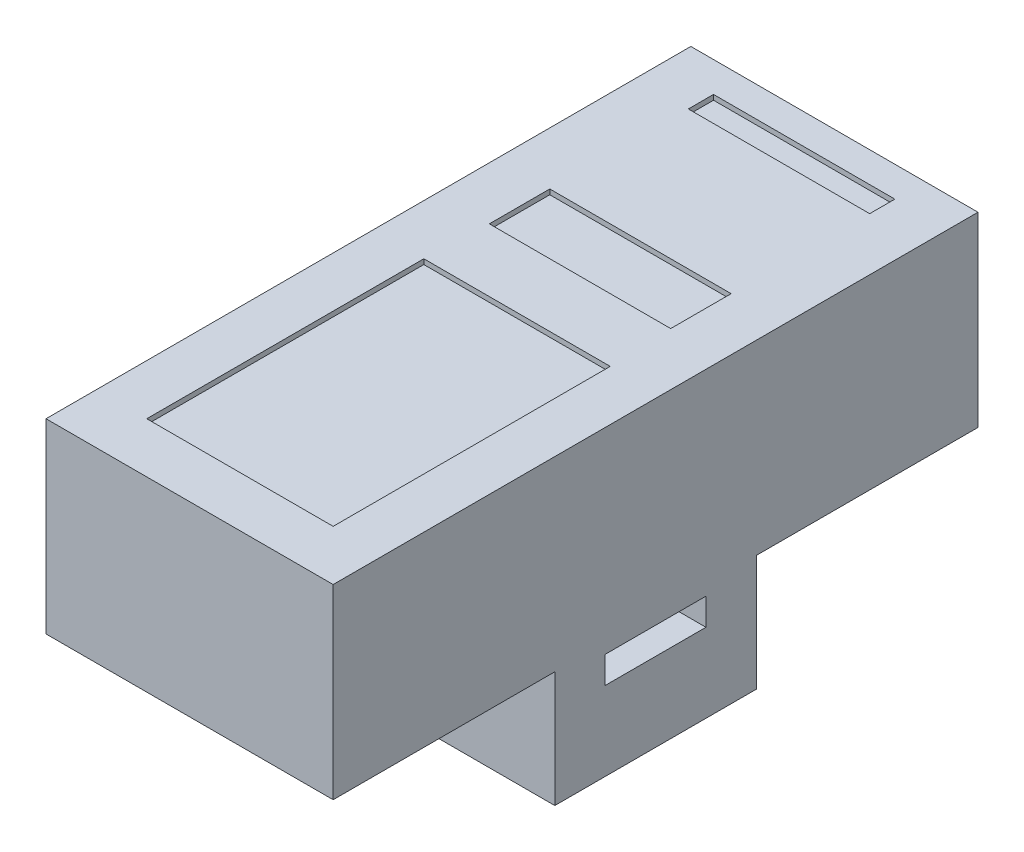
from build123d import *

# Parameters (mm, degrees)
SKETCH_1_W   = 12.8
SKETCH_1_H   = 3.7
BODY_DEPTH   = 5.7
TEETH_START  = -5.7
SKETCH_2_W   = 4
SKETCH_2_H   = 2.3
SKETCH_2_W_2 = 2
SKETCH_2_H_2 = 0.535055338
TEETH_DEPTH  = 5.7
SKETCH_3_W   = 3.7
SKETCH_3_H   = 5.5
SKETCH_3_W_2 = 3.6
SKETCH_3_H_2 = 1.2
SKETCH_3_H_3 = 0.5
CUTS_DEPTH   = 0.1
TEXT1_DEPTH  = 0.1
TEXT2_DEPTH  = 0.1


with BuildPart() as part:
    # Эскиз1 → Body (new body)
    with BuildSketch(Plane.ZY):
        with Locations((0, 3.1)):
            Rectangle(SKETCH_1_W, SKETCH_1_H)
    extrude(amount=-BODY_DEPTH)

    # Эскиз2 → Teeth (add)
    with BuildSketch(Plane.ZY.offset(TEETH_START)):
        with Locations((0, 0.1)):
            Rectangle(SKETCH_2_W, SKETCH_2_H)
        with Locations((0, 0.782472331)):
            Rectangle(SKETCH_2_W_2, SKETCH_2_H_2, mode=Mode.SUBTRACT)
    teeth = extrude(amount=TEETH_DEPTH)

    # Mirror 2: Teeth across plane
    add(teeth.mirror(Plane.ZY.offset(-2.85)))

    # Эскиз3 → Cuts (cut)
    with BuildSketch(Plane(origin=(0, 4.95, 0), x_dir=(1, 0, 0), z_dir=(0, 1, 0))):
        with Locations((2.85, -2.65)):
            Rectangle(SKETCH_3_W, SKETCH_3_H)
        with Locations((2.85, 1.95)):
            Rectangle(SKETCH_3_W_2, SKETCH_3_H_2)
        with Locations((2.85, 5.55)):
            Rectangle(SKETCH_3_W_2, SKETCH_3_H_3)
    extrude(amount=-CUTS_DEPTH, mode=Mode.SUBTRACT)

    # Эскиз4 → Text1 (add)
    # profile 1 of 5: a face of its own
    with BuildSketch(Plane.ZY):
        with BuildLine():
            Line((-4.853472261, 1.906708563), (-4.71244662, 1.873855999))
            add(Edge.make_bspline(
                [(-4.71244662, 1.873855999), (-4.715979706, 1.860638058), (-4.72289086, 1.834782123), (-4.736555053, 1.797779419), (-4.751891433, 1.76305396), (-4.769272131, 1.730697218), (-4.788887376, 1.700895225), (-4.810217446, 1.673264968), (-4.834107192, 1.64838588), (-4.859680072, 1.625683763), (-4.887135199, 1.605660557), (-4.916141558, 1.588370151), (-4.946558938, 1.573659525), (-4.978510277, 1.56156241), (-5.012016289, 1.552458293), (-5.046904452, 1.54582268), (-5.083276497, 1.541735528), (-5.108068929, 1.541197443), (-5.120699825, 1.540923307)],
                knots=[0, 0, 0, 0, 1.145254194, 2.240259345, 3.299159039, 4.322497661, 5.312016644, 6.284080175, 7.241264552, 8.196044782, 9.144516039, 10.082428046, 11.020306713, 11.970622414, 12.939253955, 13.924100776, 14.94240044, 16, 16, 16, 16], degree=3))
            add(Edge.make_bspline(
                [(-5.120699825, 1.540923307), (-5.133659368, 1.541111586), (-5.159013679, 1.541479938), (-5.196156283, 1.544476021), (-5.231482546, 1.549672259), (-5.264926498, 1.556891689), (-5.296600707, 1.565818065), (-5.326373829, 1.577048237), (-5.354193715, 1.590501175), (-5.380292419, 1.605800642), (-5.404559093, 1.623181526), (-5.427545568, 1.642174764), (-5.448693809, 1.663303218), (-5.468532602, 1.686068026), (-5.486629851, 1.710769488), (-5.503651359, 1.737072024), (-5.518766314, 1.765439083), (-5.532534865, 1.79534474), (-5.544619817, 1.826499454), (-5.555310773, 1.858287833), (-5.564051213, 1.890773219), (-5.571576169, 1.923682253), (-5.577042684, 1.957291842), (-5.581382928, 1.991349812), (-5.583769281, 2.026064967), (-5.5840833, 2.049400241), (-5.584241491, 2.061155679)],
                knots=[0, 0, 0, 0, 1.180702053, 2.309949215, 3.392367133, 4.431746864, 5.425408375, 6.388154007, 7.326956194, 8.237882283, 9.141054626, 10.043899035, 10.951650021, 11.86168169, 12.792564695, 13.739356664, 14.713891418, 15.718426911, 16.737522708, 17.757217648, 18.772674716, 19.801476837, 20.831699174, 21.873853055, 22.928926693, 24, 24, 24, 24], degree=3))
            add(Edge.make_bspline(
                [(-5.584241491, 2.061155679), (-5.584015245, 2.073846148), (-5.583568239, 2.09891931), (-5.581044898, 2.135915489), (-5.576410436, 2.171621328), (-5.569974516, 2.206060312), (-5.561830503, 2.239260334), (-5.551777631, 2.271237567), (-5.53994307, 2.301951097), (-5.526362898, 2.331434793), (-5.510946892, 2.359359537), (-5.494155156, 2.385765028), (-5.475587143, 2.4102177), (-5.455793366, 2.433184726), (-5.434279463, 2.454283681), (-5.411111129, 2.473562358), (-5.386488249, 2.491196604), (-5.360414417, 2.507022708), (-5.333230449, 2.520909287), (-5.305340115, 2.533278184), (-5.276632482, 2.543416176), (-5.247335152, 2.551845509), (-5.217385052, 2.558556041), (-5.1867122, 2.563043395), (-5.155344937, 2.565967702), (-5.134194679, 2.566364016), (-5.123504312, 2.566564332)],
                knots=[0, 0, 0, 0, 1.185634383, 2.342514083, 3.462112933, 4.547331452, 5.613960142, 6.653690668, 7.676612054, 8.686959706, 9.683658101, 10.654407272, 11.607580201, 12.5494388, 13.484601218, 14.419076806, 15.362504069, 16.311442244, 17.265594461, 18.212500624, 19.159571152, 20.107257795, 21.059246075, 22.024387127, 23.001429356, 24, 24, 24, 24], degree=3))
            add(Edge.make_bspline(
                [(-5.123504312, 2.566564332), (-5.111543231, 2.566338872), (-5.088032543, 2.565895707), (-5.053534796, 2.562250589), (-5.020494962, 2.556145415), (-4.988769874, 2.548136004), (-4.958689369, 2.537169454), (-4.929926874, 2.524131486), (-4.902768518, 2.508467947), (-4.877002985, 2.490609298), (-4.8530497, 2.470522606), (-4.83057346, 2.448687734), (-4.81049073, 2.424558972), (-4.79200611, 2.398720277), (-4.77570119, 2.370813355), (-4.760976127, 2.341081525), (-4.748313001, 2.309303765), (-4.741537598, 2.287169676), (-4.738087645, 2.275899268)],
                knots=[0, 0, 0, 0, 1.098391872, 2.158997981, 3.181470371, 4.182549255, 5.160268219, 6.118029851, 7.079534476, 8.035645336, 8.993622929, 9.94770573, 10.909620999, 11.872786677, 12.862530088, 13.874594564, 14.917769567, 16, 16, 16, 16], degree=3))
            Line((-4.738087645, 2.275899268), (-4.879113286, 2.245650871))
            add(Edge.make_bspline(
                [(-4.879113286, 2.245650871), (-4.88188281, 2.25430033), (-4.887303624, 2.271229997), (-4.89692881, 2.295357782), (-4.90732369, 2.317756249), (-4.918735879, 2.338273144), (-4.931190109, 2.356913381), (-4.944399592, 2.373903505), (-4.958680814, 2.388926392), (-4.973743284, 2.402328433), (-4.989975958, 2.413745689), (-5.006998273, 2.423863257), (-5.025169143, 2.432234001), (-5.044227167, 2.439313922), (-5.064350478, 2.444702505), (-5.085457132, 2.448493585), (-5.107565673, 2.450687677), (-5.122631402, 2.451013527), (-5.130315209, 2.451179717)],
                knots=[0, 0, 0, 0, 1.235697765, 2.418642872, 3.532555292, 4.594392283, 5.610119701, 6.580908344, 7.519430642, 8.427315627, 9.319973334, 10.216139639, 11.118687699, 12.038725643, 12.980015607, 13.949697744, 14.954307006, 16, 16, 16, 16], degree=3))
            add(Edge.make_bspline(
                [(-5.130315209, 2.451179717), (-5.139136923, 2.451051723), (-5.156486631, 2.450799996), (-5.181975438, 2.448044871), (-5.206453559, 2.443986842), (-5.229738558, 2.437901478), (-5.251957852, 2.430314612), (-5.272979589, 2.420867621), (-5.292982589, 2.40979464), (-5.311743608, 2.397029173), (-5.329104977, 2.382678332), (-5.345537833, 2.367507248), (-5.360253216, 2.350808375), (-5.373812269, 2.333132343), (-5.385820151, 2.314166802), (-5.396629257, 2.294170086), (-5.406170686, 2.272978307), (-5.416571492, 2.243152483), (-5.427176508, 2.204737511), (-5.436376372, 2.157730037), (-5.442236469, 2.109981963), (-5.442888699, 2.077865738), (-5.44321585, 2.06175664)],
                knots=[0, 0, 0, 0, 0.935256702, 1.839373932, 2.716087708, 3.564631604, 4.388828665, 5.203538865, 6.005592122, 6.810952829, 7.606223804, 8.392839071, 9.180346482, 9.963639178, 10.753404291, 11.558266631, 12.372976832, 13.215232055, 14.905983541, 16.594894834, 18.292041732, 20, 20, 20, 20], degree=3))
            add(Edge.make_bspline(
                [(-5.44321585, 2.06175664), (-5.442846871, 2.041502146), (-5.442131016, 2.002206592), (-5.435067295, 1.945260844), (-5.424297683, 1.89214579), (-5.411300313, 1.850705464), (-5.398262645, 1.8201383), (-5.387718434, 1.798731674), (-5.375682638, 1.77892302), (-5.362454631, 1.760599844), (-5.347864023, 1.743815593), (-5.332114089, 1.728481108), (-5.315201312, 1.714448835), (-5.296925292, 1.702375651), (-5.277989495, 1.691655716), (-5.258632875, 1.682123345), (-5.238843246, 1.674061288), (-5.218540765, 1.667798518), (-5.198010533, 1.662386614), (-5.17702643, 1.658851305), (-5.155594441, 1.656856087), (-5.141203391, 1.656492109), (-5.133920979, 1.656307922)],
                knots=[0, 0, 0, 0, 2.10686522, 4.087509323, 5.961373225, 7.741398778, 8.594514555, 9.418024779, 10.222433421, 11.003575649, 11.767087398, 12.533660211, 13.289033706, 14.050297079, 14.809623433, 15.552362432, 16.294320901, 17.0305302, 17.761969017, 18.502233515, 19.242073914, 20, 20, 20, 20], degree=3))
            add(Edge.make_bspline(
                [(-5.133920979, 1.656307922), (-5.125230417, 1.656490182), (-5.108063485, 1.656850208), (-5.082894582, 1.660001542), (-5.058632107, 1.664645444), (-5.035569997, 1.671811455), (-5.013398038, 1.680585395), (-4.992297893, 1.691405198), (-4.972335919, 1.704418263), (-4.953277318, 1.719193375), (-4.935473549, 1.736004929), (-4.919157351, 1.754717481), (-4.904519878, 1.77541634), (-4.890947258, 1.797769318), (-4.879543762, 1.822444183), (-4.868981432, 1.848705484), (-4.860180136, 1.87698485), (-4.855740339, 1.896658331), (-4.853472261, 1.906708563)],
                knots=[0, 0, 0, 0, 1.013374089, 2.001772144, 2.95501459, 3.891367103, 4.814208647, 5.733921849, 6.652182523, 7.590185968, 8.54346024, 9.504121027, 10.481158517, 11.497760682, 12.549996529, 13.647863555, 14.798406869, 16, 16, 16, 16], degree=3))
        make_face()
    # profile 2 of 5: a face of its own
    with BuildSketch(Plane.ZY):
        Polygon((-0.686805594, 1.55374382), (-0.686805594, 2.55374382), (-0.537767132, 2.55374382), (-0.058600466, 1.807549909), (-0.058600466, 2.55374382), (0.082425175, 2.55374382), (0.082425175, 1.55374382), (-0.066613286, 1.55374382), (-0.545779953, 2.29993773), (-0.545779953, 1.55374382), align=None)
    # profile 3 of 5: a face of its own
    with BuildSketch(Plane.ZY):
        with BuildLine():
            add(Edge.make_bspline(
                [(0.261912355, 2.040522666), (0.262259916, 2.060571804), (0.262937122, 2.099636533), (0.269264623, 2.156519811), (0.27953886, 2.210039536), (0.29422679, 2.260191537), (0.312843784, 2.307054402), (0.335476297, 2.350734246), (0.3628051, 2.390736645), (0.39372094, 2.427442394), (0.428252513, 2.459892967), (0.465018823, 2.488713724), (0.504478967, 2.512753644), (0.546268363, 2.532602692), (0.590564556, 2.547842216), (0.637243176, 2.55851127), (0.686254299, 2.565393846), (0.71975455, 2.566168503), (0.736872291, 2.566564332)],
                knots=[0, 0, 0, 0, 1.203621547, 2.345195544, 3.432004029, 4.472479546, 5.478447225, 6.455936844, 7.420185704, 8.381829745, 9.332027588, 10.260832629, 11.182364398, 12.100723901, 13.034044877, 13.989196293, 14.972532542, 16, 16, 16, 16], degree=3))
            add(Edge.make_bspline(
                [(0.736872291, 2.566564332), (0.748162617, 2.566367182), (0.770583163, 2.565975677), (0.80372994, 2.562996847), (0.836024961, 2.557680152), (0.867436423, 2.550555185), (0.89804983, 2.541207537), (0.927883463, 2.530172923), (0.956676162, 2.516499483), (0.984619476, 2.501190706), (1.011383556, 2.484067177), (1.036536372, 2.46515085), (1.060017674, 2.444584787), (1.08214288, 2.422707038), (1.102173703, 2.398779261), (1.120937667, 2.373530336), (1.137895579, 2.346512559), (1.153107609, 2.317947295), (1.16670871, 2.288275729), (1.178333477, 2.257374885), (1.188315452, 2.225615439), (1.196671208, 2.19280941), (1.202666688, 2.158968014), (1.207440953, 2.124237068), (1.209953781, 2.088503062), (1.210402894, 2.064364104), (1.210630303, 2.052141256)],
                knots=[0, 0, 0, 0, 1.034375294, 2.054082248, 3.045783978, 4.031219655, 5.002789406, 5.976610191, 6.94273282, 7.920236376, 8.894345378, 9.851183672, 10.800797181, 11.752517031, 12.698794154, 13.65688337, 14.632873302, 15.61821402, 16.620222298, 17.621258913, 18.640965868, 19.669244166, 20.720417492, 21.788124603, 22.880008887, 24, 24, 24, 24], degree=3))
            add(Edge.make_bspline(
                [(1.210630303, 2.052141256), (1.210421947, 2.039716852), (1.210010302, 2.0151703), (1.207224943, 1.978907532), (1.202327315, 1.943685793), (1.195831444, 1.909400059), (1.187127177, 1.876121704), (1.176783492, 1.843755318), (1.164272221, 1.812493681), (1.15014213, 1.782261446), (1.134153937, 1.753474412), (1.116517876, 1.726333871), (1.097221452, 1.701093701), (1.076557776, 1.67744427), (1.054044296, 1.655808474), (1.029958235, 1.635984002), (1.004392204, 1.617783887), (0.977260313, 1.601701046), (0.949049482, 1.58760386), (0.920317959, 1.575097117), (0.8910444, 1.564430869), (0.861128759, 1.555786935), (0.830652641, 1.549254957), (0.799701811, 1.544363742), (0.768174807, 1.541547364), (0.746960468, 1.541132395), (0.736271329, 1.540923307)],
                knots=[0, 0, 0, 0, 1.141429366, 2.255090526, 3.338676798, 4.407031443, 5.458968682, 6.496860253, 7.526652771, 8.550250826, 9.560787671, 10.54935636, 11.521089193, 12.477323897, 13.431786008, 14.386110112, 15.340986122, 16.312041, 17.28047646, 18.236612773, 19.189437236, 20.140779471, 21.09494583, 22.051062463, 23.018000708, 24, 24, 24, 24], degree=3))
            add(Edge.make_bspline(
                [(0.736271329, 1.540923307), (0.72477813, 1.54109335), (0.702012982, 1.541430163), (0.668365479, 1.544792133), (0.635555073, 1.549920935), (0.60367715, 1.557325376), (0.572775269, 1.566984992), (0.542812867, 1.578676686), (0.513684563, 1.592244201), (0.48575179, 1.608076021), (0.459109621, 1.625679302), (0.434016281, 1.64496654), (0.410485645, 1.665759986), (0.388895285, 1.688403331), (0.368545956, 1.712075745), (0.350251315, 1.737657116), (0.333413889, 1.764567286), (0.318531925, 1.793065657), (0.305088297, 1.822305366), (0.293761751, 1.852295766), (0.283807911, 1.882594877), (0.275880686, 1.913389452), (0.269563652, 1.944608453), (0.265315904, 1.976199934), (0.262248149, 2.008210945), (0.262024849, 2.029697891), (0.261912355, 2.040522666)],
                knots=[0, 0, 0, 0, 1.072727997, 2.12480551, 3.153819198, 4.171534612, 5.177148798, 6.173931848, 7.17235114, 8.174500385, 9.168706755, 10.151274001, 11.127173509, 12.097141049, 13.070188938, 14.039134204, 15.03036519, 16.031505612, 17.038625933, 18.033164522, 19.022845559, 20.014762458, 21.000193215, 21.994692725, 22.989758729, 24, 24, 24, 24], degree=3))
        make_face()
        with BuildLine():
            add(Edge.make_bspline(
                [(0.402937996, 2.038920102), (0.403154111, 2.024482913), (0.40357552, 1.996331415), (0.40839667, 1.955288027), (0.415711994, 1.916561501), (0.425795396, 1.880043121), (0.439349959, 1.846094049), (0.455556193, 1.814388067), (0.474959767, 1.785135939), (0.497132579, 1.758419495), (0.521520132, 1.734419443), (0.547580706, 1.713456674), (0.575320161, 1.695901838), (0.604430956, 1.681406574), (0.635122179, 1.670091698), (0.66730191, 1.662146677), (0.700993793, 1.657177712), (0.723967502, 1.656601464), (0.735670368, 1.656307922)],
                knots=[0, 0, 0, 0, 1.215430442, 2.370003584, 3.475209778, 4.53279855, 5.55522989, 6.548792651, 7.526809858, 8.505409025, 9.467826767, 10.404123909, 11.316848639, 12.227335424, 13.138360512, 14.065900994, 15.014765094, 16, 16, 16, 16], degree=3))
            add(Edge.make_bspline(
                [(0.735670368, 1.656307922), (0.747571597, 1.656605806), (0.770874171, 1.657189061), (0.805074005, 1.662071285), (0.837567676, 1.670383061), (0.868677253, 1.681447919), (0.897840307, 1.69640572), (0.925738877, 1.713921224), (0.951612445, 1.735324667), (0.976096134, 1.759367166), (0.998056354, 1.786695881), (1.017541426, 1.816637619), (1.033369727, 1.849641431), (1.047035328, 1.884980288), (1.057042069, 1.923322107), (1.064437664, 1.964231019), (1.068894406, 2.007838615), (1.069363724, 2.037774421), (1.069604662, 2.053142858)],
                knots=[0, 0, 0, 0, 0.976878588, 1.912725521, 2.8289017, 3.727303729, 4.617335839, 5.514666588, 6.426584173, 7.368641557, 8.327632997, 9.299405846, 10.294892156, 11.327373912, 12.405931897, 13.542618837, 14.738430195, 16, 16, 16, 16], degree=3))
            add(Edge.make_bspline(
                [(1.069604662, 2.053142858), (1.069519515, 2.06302991), (1.069352486, 2.082424729), (1.067140468, 2.111012913), (1.064287248, 2.138711842), (1.059943176, 2.165485772), (1.053956494, 2.191223828), (1.047324266, 2.216121954), (1.039030898, 2.23996559), (1.029620916, 2.262848244), (1.019091305, 2.28465244), (1.007215305, 2.305194359), (0.994130938, 2.324394139), (0.980191237, 2.342615789), (0.964624298, 2.359154056), (0.948179681, 2.374707525), (0.930483845, 2.388954856), (0.911713389, 2.401899773), (0.892134596, 2.413552238), (0.871787828, 2.423525236), (0.850997237, 2.432285261), (0.829414818, 2.439000189), (0.807338583, 2.444415876), (0.784679289, 2.448529595), (0.761352829, 2.45065987), (0.745623339, 2.451005191), (0.737673573, 2.451179717)],
                knots=[0, 0, 0, 0, 1.220438779, 2.394059227, 3.538503547, 4.658058814, 5.74010225, 6.800155734, 7.837851593, 8.854470756, 9.853724944, 10.825214244, 11.781044712, 12.72106398, 13.654479919, 14.581868691, 15.514082315, 16.456304431, 17.39516604, 18.324312202, 19.252140633, 20.177768678, 21.111585046, 22.057694709, 23.018348693, 24, 24, 24, 24], degree=3))
            add(Edge.make_bspline(
                [(0.737673573, 2.451179717), (0.726437662, 2.450956576), (0.704267958, 2.450516295), (0.671631514, 2.445621881), (0.640166444, 2.438308959), (0.609823917, 2.428085104), (0.580863447, 2.414547114), (0.553134994, 2.397944621), (0.526392427, 2.378729685), (0.501057437, 2.35643414), (0.477439685, 2.330822001), (0.457473245, 2.300626074), (0.440644983, 2.266567199), (0.426593695, 2.228731707), (0.415880002, 2.186826588), (0.4084755, 2.141032179), (0.403800448, 2.091300224), (0.40323283, 2.056826509), (0.402937996, 2.038920102)],
                knots=[0, 0, 0, 0, 0.895090134, 1.766112571, 2.624765742, 3.468151641, 4.313618154, 5.168136083, 6.041303099, 6.935189387, 7.854749729, 8.809996334, 9.809869957, 10.877771942, 12.021723904, 13.25217762, 14.572720513, 16, 16, 16, 16], degree=3))
        make_face(mode=Mode.SUBTRACT)
    # profile 4 of 5: a face of its own
    with BuildSketch(Plane.ZY):
        Polygon((4.082425175, 1.55374382), (4.082425175, 2.55374382), (4.231463637, 2.55374382), (4.710630303, 1.807549909), (4.710630303, 2.55374382), (4.851655944, 2.55374382), (4.851655944, 1.55374382), (4.702617483, 1.55374382), (4.223450816, 2.29993773), (4.223450816, 1.55374382), align=None)
    # profile 5 of 5: a face of its own
    with BuildSketch(Plane.ZY):
        with BuildLine():
            Line((5.761912355, 1.906708563), (5.902937996, 1.873855999))
            add(Edge.make_bspline(
                [(5.902937996, 1.873855999), (5.89940491, 1.860638058), (5.892493755, 1.834782123), (5.878829563, 1.797779419), (5.863493183, 1.76305396), (5.846112485, 1.730697218), (5.826497239, 1.700895225), (5.80516717, 1.673264968), (5.781277423, 1.64838588), (5.755704543, 1.625683763), (5.728249416, 1.605660557), (5.699243058, 1.588370151), (5.668825678, 1.573659525), (5.636874338, 1.56156241), (5.603368326, 1.552458293), (5.568480163, 1.54582268), (5.532108119, 1.541735528), (5.507315686, 1.541197443), (5.494684791, 1.540923307)],
                knots=[0, 0, 0, 0, 1.145254194, 2.240259345, 3.299159039, 4.322497661, 5.312016644, 6.284080175, 7.241264552, 8.196044782, 9.144516039, 10.082428046, 11.020306713, 11.970622414, 12.939253955, 13.924100776, 14.94240044, 16, 16, 16, 16], degree=3))
            add(Edge.make_bspline(
                [(5.494684791, 1.540923307), (5.481725247, 1.541111586), (5.456370936, 1.541479938), (5.419228333, 1.544476021), (5.383902069, 1.549672259), (5.350458117, 1.556891689), (5.318783908, 1.565818065), (5.289010786, 1.577048237), (5.261190901, 1.590501175), (5.235092196, 1.605800642), (5.210825522, 1.623181526), (5.187839048, 1.642174764), (5.166690807, 1.663303218), (5.146852013, 1.686068026), (5.128754764, 1.710769488), (5.111733257, 1.737072024), (5.096618302, 1.765439083), (5.08284975, 1.79534474), (5.070764798, 1.826499454), (5.060073842, 1.858287833), (5.051333402, 1.890773219), (5.043808447, 1.923682253), (5.038341931, 1.957291842), (5.034001687, 1.991349812), (5.031615334, 2.026064967), (5.031301315, 2.049400241), (5.031143124, 2.061155679)],
                knots=[0, 0, 0, 0, 1.180702053, 2.309949215, 3.392367133, 4.431746864, 5.425408375, 6.388154007, 7.326956194, 8.237882283, 9.141054626, 10.043899035, 10.951650021, 11.86168169, 12.792564695, 13.739356664, 14.713891418, 15.718426911, 16.737522708, 17.757217648, 18.772674716, 19.801476837, 20.831699174, 21.873853055, 22.928926693, 24, 24, 24, 24], degree=3))
            add(Edge.make_bspline(
                [(5.031143124, 2.061155679), (5.03136937, 2.073846148), (5.031816376, 2.09891931), (5.034339717, 2.135915489), (5.038974179, 2.171621328), (5.045410099, 2.206060312), (5.053554112, 2.239260334), (5.063606984, 2.271237567), (5.075441545, 2.301951097), (5.089021717, 2.331434793), (5.104437724, 2.359359537), (5.12122946, 2.385765028), (5.139797473, 2.4102177), (5.159591249, 2.433184726), (5.181105152, 2.454283681), (5.204273487, 2.473562358), (5.228896367, 2.491196604), (5.254970198, 2.507022708), (5.282154166, 2.520909287), (5.310044501, 2.533278184), (5.338752134, 2.543416176), (5.368049463, 2.551845509), (5.397999563, 2.558556041), (5.428672415, 2.563043395), (5.460039678, 2.565967702), (5.481189936, 2.566364016), (5.491880303, 2.566564332)],
                knots=[0, 0, 0, 0, 1.185634383, 2.342514083, 3.462112933, 4.547331452, 5.613960142, 6.653690668, 7.676612054, 8.686959706, 9.683658101, 10.654407272, 11.607580201, 12.5494388, 13.484601218, 14.419076806, 15.362504069, 16.311442244, 17.265594461, 18.212500624, 19.159571152, 20.107257795, 21.059246075, 22.024387127, 23.001429356, 24, 24, 24, 24], degree=3))
            add(Edge.make_bspline(
                [(5.491880303, 2.566564332), (5.503841384, 2.566338872), (5.527352073, 2.565895707), (5.561849819, 2.562250589), (5.594889653, 2.556145415), (5.626614742, 2.548136004), (5.656695246, 2.537169454), (5.685457741, 2.524131486), (5.712616098, 2.508467947), (5.73838163, 2.490609298), (5.762334916, 2.470522606), (5.784811155, 2.448687734), (5.804893886, 2.424558972), (5.823378505, 2.398720277), (5.839683425, 2.370813355), (5.854408489, 2.341081525), (5.867071615, 2.309303765), (5.873847018, 2.287169676), (5.87729697, 2.275899268)],
                knots=[0, 0, 0, 0, 1.098391872, 2.158997981, 3.181470371, 4.182549255, 5.160268219, 6.118029851, 7.079534476, 8.035645336, 8.993622929, 9.94770573, 10.909620999, 11.872786677, 12.862530088, 13.874594564, 14.917769567, 16, 16, 16, 16], degree=3))
            Line((5.87729697, 2.275899268), (5.736271329, 2.245650871))
            add(Edge.make_bspline(
                [(5.736271329, 2.245650871), (5.733501806, 2.25430033), (5.728080991, 2.271229997), (5.718455805, 2.295357782), (5.708060925, 2.317756249), (5.696648736, 2.338273144), (5.684194507, 2.356913381), (5.670985023, 2.373903505), (5.656703801, 2.388926392), (5.641641331, 2.402328433), (5.625408657, 2.413745689), (5.608386343, 2.423863257), (5.590215473, 2.432234001), (5.571157449, 2.439313922), (5.551034138, 2.444702505), (5.529927484, 2.448493585), (5.507818942, 2.450687677), (5.492753213, 2.451013527), (5.485069406, 2.451179717)],
                knots=[0, 0, 0, 0, 1.235697765, 2.418642872, 3.532555292, 4.594392283, 5.610119701, 6.580908344, 7.519430642, 8.427315627, 9.319973334, 10.216139639, 11.118687699, 12.038725643, 12.980015607, 13.949697744, 14.954307006, 16, 16, 16, 16], degree=3))
            add(Edge.make_bspline(
                [(5.485069406, 2.451179717), (5.476247692, 2.451051723), (5.458897985, 2.450799996), (5.433409177, 2.448044871), (5.408931057, 2.443986842), (5.385646058, 2.437901478), (5.363426763, 2.430314612), (5.342405026, 2.420867621), (5.322402026, 2.40979464), (5.303641007, 2.397029173), (5.286279638, 2.382678332), (5.269846782, 2.367507248), (5.255131399, 2.350808375), (5.241572347, 2.333132343), (5.229564464, 2.314166802), (5.218755358, 2.294170086), (5.209213929, 2.272978307), (5.198813123, 2.243152483), (5.188208107, 2.204737511), (5.179008243, 2.157730037), (5.173148147, 2.109981963), (5.172495916, 2.077865738), (5.172168765, 2.06175664)],
                knots=[0, 0, 0, 0, 0.935256702, 1.839373932, 2.716087708, 3.564631604, 4.388828665, 5.203538865, 6.005592122, 6.810952829, 7.606223804, 8.392839071, 9.180346482, 9.963639178, 10.753404291, 11.558266631, 12.372976832, 13.215232055, 14.905983541, 16.594894834, 18.292041732, 20, 20, 20, 20], degree=3))
            add(Edge.make_bspline(
                [(5.172168765, 2.06175664), (5.172537745, 2.041502146), (5.173253599, 2.002206592), (5.18031732, 1.945260844), (5.191086932, 1.89214579), (5.204084302, 1.850705464), (5.21712197, 1.8201383), (5.227666181, 1.798731674), (5.239701977, 1.77892302), (5.252929984, 1.760599844), (5.267520593, 1.743815593), (5.283270526, 1.728481108), (5.300183303, 1.714448835), (5.318459324, 1.702375651), (5.337395121, 1.691655716), (5.35675174, 1.682123345), (5.376541369, 1.674061288), (5.39684385, 1.667798518), (5.417374082, 1.662386614), (5.438358185, 1.658851305), (5.459790174, 1.656856087), (5.474181225, 1.656492109), (5.481463637, 1.656307922)],
                knots=[0, 0, 0, 0, 2.10686522, 4.087509323, 5.961373225, 7.741398778, 8.594514555, 9.418024779, 10.222433421, 11.003575649, 11.767087398, 12.533660211, 13.289033706, 14.050297079, 14.809623433, 15.552362432, 16.294320901, 17.0305302, 17.761969017, 18.502233515, 19.242073914, 20, 20, 20, 20], degree=3))
            add(Edge.make_bspline(
                [(5.481463637, 1.656307922), (5.490154198, 1.656490182), (5.507321131, 1.656850208), (5.532490033, 1.660001542), (5.556752508, 1.664645444), (5.579814619, 1.671811455), (5.601986577, 1.680585395), (5.623086722, 1.691405198), (5.643048696, 1.704418263), (5.662107297, 1.719193375), (5.679911067, 1.736004929), (5.696227264, 1.754717481), (5.710864737, 1.77541634), (5.724437358, 1.797769318), (5.735840854, 1.822444183), (5.746403184, 1.848705484), (5.75520448, 1.87698485), (5.759644277, 1.896658331), (5.761912355, 1.906708563)],
                knots=[0, 0, 0, 0, 1.013374089, 2.001772144, 2.95501459, 3.891367103, 4.814208647, 5.733921849, 6.652182523, 7.590185968, 8.54346024, 9.504121027, 10.481158517, 11.497760682, 12.549996529, 13.647863555, 14.798406869, 16, 16, 16, 16], degree=3))
        make_face()
    extrude(amount=TEXT1_DEPTH)

    # Эскиз5 → Text2 (add)
    # profile 1 of 9: a face of its own
    with BuildSketch(Plane.ZY):
        with BuildLine():
            Line((-3.035853379, 3.734195884), (-3.164058507, 3.734195884))
            Line((-3.164058507, 3.734195884), (-3.164058507, 4.513442679))
            add(Edge.make_bspline(
                [(-3.164058507, 4.513442679), (-3.17144057, 4.506323587), (-3.186783378, 4.491527337), (-3.212718774, 4.470586947), (-3.241665991, 4.449362974), (-3.27324913, 4.428953752), (-3.305442798, 4.40974067), (-3.336553833, 4.392461457), (-3.366062823, 4.37783905), (-3.385500555, 4.36984346), (-3.394827738, 4.366006781)],
                knots=[0, 0, 0, 0, 0.893362401, 1.856755847, 2.901947673, 4.020460078, 5.132200827, 6.168787962, 7.121294059, 8, 8, 8, 8], degree=3))
            Line((-3.394827738, 4.366006781), (-3.394827738, 4.484195884))
            add(Edge.make_bspline(
                [(-3.394827738, 4.484195884), (-3.378807337, 4.492446422), (-3.347232075, 4.508707745), (-3.302623059, 4.536793285), (-3.260975743, 4.567239167), (-3.222979556, 4.600038649), (-3.188918396, 4.633565608), (-3.160214561, 4.667395627), (-3.136197019, 4.700288642), (-3.124146963, 4.723227873), (-3.11838543, 4.734195884)],
                knots=[0, 0, 0, 0, 1.141258006, 2.249351951, 3.335817539, 4.406819942, 5.426913362, 6.360259544, 7.215985427, 8, 8, 8, 8], degree=3))
            Line((-3.11838543, 4.734195884), (-3.035853379, 4.734195884))
            Line((-3.035853379, 4.734195884), (-3.035853379, 3.734195884))
        make_face()
    # profile 2 of 9: a face of its own
    with BuildSketch(Plane.ZY):
        Polygon((-2.800877417, 3.734195884), (-2.403842161, 4.734195884), (-2.244787674, 4.734195884), (-1.847752417, 3.734195884), (-1.99739184, 3.734195884), (-2.111173892, 4.041888191), (-2.537455943, 4.041888191), (-2.651237994, 3.734195884), align=None)
        with BuildLine():
            Line((-2.494987994, 4.157272807), (-2.15364184, 4.157272807))
            Line((-2.15364184, 4.157272807), (-2.250797289, 4.42009332))
            add(Edge.make_bspline(
                [(-2.250797289, 4.42009332), (-2.254521882, 4.430248346), (-2.261804165, 4.45010334), (-2.272664242, 4.478950971), (-2.282585834, 4.506345864), (-2.292314769, 4.531895218), (-2.301097253, 4.555970162), (-2.309192293, 4.57840808), (-2.31719822, 4.599053019), (-2.322002689, 4.612391777), (-2.324314917, 4.618811268)],
                knots=[0, 0, 0, 0, 1.225184869, 2.395467751, 3.491410812, 4.525364584, 5.492066482, 6.394148129, 7.227157926, 8, 8, 8, 8], degree=3))
            add(Edge.make_bspline(
                [(-2.324314917, 4.618811268), (-2.328139789, 4.602981367), (-2.335805303, 4.571256292), (-2.351855025, 4.524774801), (-2.370215348, 4.478718404), (-2.385126119, 4.449039976), (-2.392624212, 4.434115756)],
                knots=[0, 0, 0, 0, 0.9891762, 1.982431084, 2.985436691, 4, 4, 4, 4], degree=3))
            Line((-2.392624212, 4.434115756), (-2.494987994, 4.157272807))
        make_face(mode=Mode.SUBTRACT)
    # profile 3 of 9: a face of its own
    with BuildSketch(Plane.ZY):
        with BuildLine():
            Line((-0.958930302, 3.734195884), (-1.08713543, 3.734195884))
            Line((-1.08713543, 3.734195884), (-1.08713543, 4.513442679))
            add(Edge.make_bspline(
                [(-1.08713543, 4.513442679), (-1.094517493, 4.506323587), (-1.109860301, 4.491527337), (-1.135795697, 4.470586947), (-1.164742914, 4.449362974), (-1.196326053, 4.428953752), (-1.228519721, 4.40974067), (-1.259630756, 4.392461457), (-1.289139746, 4.37783905), (-1.308577478, 4.36984346), (-1.317904661, 4.366006781)],
                knots=[0, 0, 0, 0, 0.893362401, 1.856755847, 2.901947673, 4.020460078, 5.132200827, 6.168787962, 7.121294059, 8, 8, 8, 8], degree=3))
            Line((-1.317904661, 4.366006781), (-1.317904661, 4.484195884))
            add(Edge.make_bspline(
                [(-1.317904661, 4.484195884), (-1.30188426, 4.492446422), (-1.270308998, 4.508707745), (-1.225699982, 4.536793285), (-1.184052666, 4.567239167), (-1.146056479, 4.600038649), (-1.111995319, 4.633565608), (-1.083291485, 4.667395627), (-1.059273942, 4.700288642), (-1.047223887, 4.723227873), (-1.041462353, 4.734195884)],
                knots=[0, 0, 0, 0, 1.141258006, 2.249351951, 3.335817539, 4.406819942, 5.426913362, 6.360259544, 7.215985427, 8, 8, 8, 8], degree=3))
            Line((-1.041462353, 4.734195884), (-0.958930302, 4.734195884))
            Line((-0.958930302, 4.734195884), (-0.958930302, 3.734195884))
        make_face()
    # profile 4 of 9: a face of its own
    with BuildSketch(Plane.ZY):
        with BuildLine():
            Line((-0.010212353, 3.862401012), (-0.010212353, 3.734195884))
            Line((-0.010212353, 3.734195884), (-0.664058507, 3.734195884))
            add(Edge.make_bspline(
                [(-0.664058507, 3.734195884), (-0.664071893, 3.741815475), (-0.66409862, 3.757029118), (-0.661524226, 3.779529132), (-0.657492211, 3.801730663), (-0.652933212, 3.815967623), (-0.650637033, 3.823138191)],
                knots=[0, 0, 0, 0, 1.01057331, 2.01775941, 3.001627217, 4, 4, 4, 4], degree=3))
            add(Edge.make_bspline(
                [(-0.650637033, 3.823138191), (-0.646394457, 3.834854046), (-0.637755874, 3.858709454), (-0.620254014, 3.893129477), (-0.599667691, 3.927341335), (-0.579624008, 3.955194617), (-0.561268322, 3.977447442), (-0.545874688, 3.994857703), (-0.528815718, 4.012679156), (-0.510105076, 4.030908547), (-0.489922839, 4.049663939), (-0.46824147, 4.069007882), (-0.444804945, 4.088579879), (-0.428443798, 4.101553014), (-0.420068122, 4.108194281)],
                knots=[0, 0, 0, 0, 1.204657718, 2.452881516, 3.728232997, 5.065887527, 5.768225529, 6.518857853, 7.313994055, 8.154655305, 9.046094665, 9.979688118, 10.965752482, 12, 12, 12, 12], degree=3))
            add(Edge.make_bspline(
                [(-0.420068122, 4.108194281), (-0.407201017, 4.119024315), (-0.382424588, 4.139878233), (-0.347436388, 4.170823514), (-0.315480363, 4.19955796), (-0.287065376, 4.226585202), (-0.261959021, 4.251643092), (-0.24010235, 4.274674858), (-0.2213073, 4.295608623), (-0.205803322, 4.315202101), (-0.192722141, 4.333703794), (-0.181636994, 4.351751053), (-0.172398996, 4.369659123), (-0.164704979, 4.38737134), (-0.158619665, 4.404963449), (-0.154471659, 4.422486702), (-0.151658624, 4.439767228), (-0.151377177, 4.451265881), (-0.151237994, 4.456952294)],
                knots=[0, 0, 0, 0, 1.782554561, 3.432421876, 4.950675607, 6.337395053, 7.588547463, 8.709982106, 9.702713005, 10.569305638, 11.356701089, 12.103210377, 12.812277205, 13.490692607, 14.148717897, 14.782152033, 15.397739362, 16, 16, 16, 16], degree=3))
            add(Edge.make_bspline(
                [(-0.151237994, 4.456952294), (-0.151377194, 4.462572359), (-0.151650297, 4.473598621), (-0.154241484, 4.489735487), (-0.157848624, 4.505275674), (-0.163680271, 4.519939426), (-0.170621686, 4.534160992), (-0.179525728, 4.547490989), (-0.189825873, 4.560261636), (-0.201618667, 4.57213623), (-0.21449916, 4.583276495), (-0.228891276, 4.592536761), (-0.243849743, 4.60087376), (-0.259890618, 4.607577185), (-0.276987833, 4.61249963), (-0.29501693, 4.616072057), (-0.313975048, 4.618337167), (-0.32691263, 4.618650839), (-0.333529661, 4.618811268)],
                knots=[0, 0, 0, 0, 0.988194508, 1.938783882, 2.870742509, 3.789494954, 4.709148727, 5.651055405, 6.603531303, 7.592354411, 8.592907906, 9.593461401, 10.59787167, 11.603930315, 12.645063138, 13.723588815, 14.835711238, 16, 16, 16, 16], degree=3))
            add(Edge.make_bspline(
                [(-0.333529661, 4.618811268), (-0.340480667, 4.618651633), (-0.354084298, 4.618339215), (-0.373969163, 4.616065071), (-0.392846395, 4.612590487), (-0.410670938, 4.607278144), (-0.427421096, 4.600585897), (-0.443028651, 4.592162141), (-0.457743543, 4.582653243), (-0.471102345, 4.571395426), (-0.483182535, 4.558912803), (-0.493906931, 4.545323002), (-0.502693962, 4.530363769), (-0.509950654, 4.514364023), (-0.515785642, 4.497273468), (-0.520021645, 4.478961449), (-0.522331143, 4.45948084), (-0.522795563, 4.446140525), (-0.523032866, 4.439324089)],
                knots=[0, 0, 0, 0, 1.131143733, 2.213731411, 3.253917892, 4.251203413, 5.236093891, 6.184197493, 7.13373276, 8.082770301, 9.020476205, 9.957489029, 10.893177274, 11.836722509, 12.812818608, 13.827831385, 14.890097571, 16, 16, 16, 16], degree=3))
            Line((-0.523032866, 4.439324089), (-0.651237994, 4.452144602))
            add(Edge.make_bspline(
                [(-0.651237994, 4.452144602), (-0.649926274, 4.463317992), (-0.647374434, 4.485054861), (-0.64101815, 4.516537054), (-0.632094502, 4.545824518), (-0.621416605, 4.573325582), (-0.608030854, 4.598572094), (-0.592899415, 4.62208625), (-0.575052581, 4.643122281), (-0.555336565, 4.662343271), (-0.533535355, 4.679282021), (-0.509853741, 4.694080371), (-0.484302555, 4.706458277), (-0.457024108, 4.716706667), (-0.427955776, 4.724482378), (-0.397138681, 4.730058297), (-0.364523263, 4.733495357), (-0.342151951, 4.733959043), (-0.330725174, 4.734195884)],
                knots=[0, 0, 0, 0, 1.130804643, 2.199883102, 3.223565206, 4.205909148, 5.160801384, 6.091796021, 7.01151579, 7.927798993, 8.855738875, 9.7815393, 10.730299821, 11.705391175, 12.706931101, 13.751121791, 14.851322166, 16, 16, 16, 16], degree=3))
            add(Edge.make_bspline(
                [(-0.330725174, 4.734195884), (-0.319161624, 4.733997871), (-0.296635762, 4.733612141), (-0.26381196, 4.72966535), (-0.232841795, 4.72351826), (-0.203611733, 4.714951097), (-0.176294467, 4.703716993), (-0.150868986, 4.689991453), (-0.127218056, 4.673908368), (-0.105736838, 4.65527467), (-0.086366661, 4.634932868), (-0.069391558, 4.613223779), (-0.055199554, 4.590240146), (-0.043115945, 4.566295252), (-0.034153085, 4.540883156), (-0.027850237, 4.514349341), (-0.023567269, 4.486671133), (-0.023213369, 4.467786228), (-0.023032866, 4.458154217)],
                knots=[0, 0, 0, 0, 1.195390245, 2.328627238, 3.413424916, 4.457841177, 5.473507151, 6.462241215, 7.441013641, 8.425227782, 9.397253344, 10.342087291, 11.269524934, 12.186751184, 13.110685745, 14.048630397, 15.004728144, 16, 16, 16, 16], degree=3))
            add(Edge.make_bspline(
                [(-0.023032866, 4.458154217), (-0.023308491, 4.448258417), (-0.023860348, 4.428444978), (-0.028167669, 4.39882973), (-0.035537544, 4.369535874), (-0.045308031, 4.340206885), (-0.05865655, 4.310726358), (-0.075520137, 4.280687608), (-0.09644126, 4.249979676), (-0.116561514, 4.223874521), (-0.135290205, 4.201991819), (-0.151891419, 4.183981076), (-0.171098064, 4.164845867), (-0.192189625, 4.143923494), (-0.216026318, 4.121956536), (-0.24192326, 4.09828718), (-0.270447346, 4.073538313), (-0.290248621, 4.056631075), (-0.300476776, 4.047897807)],
                knots=[0, 0, 0, 0, 0.927118007, 1.856282007, 2.79721255, 3.754929441, 4.749232485, 5.824981375, 6.979078785, 8.228161913, 8.911614355, 9.677694854, 10.522803217, 11.452009355, 12.461436787, 13.560019032, 14.739651695, 16, 16, 16, 16], degree=3))
            add(Edge.make_bspline(
                [(-0.300476776, 4.047897807), (-0.309235646, 4.040767153), (-0.325937463, 4.027170094), (-0.349699032, 4.007458073), (-0.370982171, 3.989382684), (-0.390284583, 3.973533512), (-0.406903285, 3.959143952), (-0.421423649, 3.946844204), (-0.433318142, 3.936015841), (-0.45143135, 3.919567339), (-0.474373272, 3.896121663), (-0.491277861, 3.873340154), (-0.499395045, 3.862401012)],
                knots=[0, 0, 0, 0, 1.241996727, 2.368296581, 3.394949853, 4.3125351, 5.114548721, 5.812230366, 6.404953749, 6.883082049, 8.503329734, 10, 10, 10, 10], degree=3))
            Line((-0.499395045, 3.862401012), (-0.010212353, 3.862401012))
        make_face()
    # profile 5 of 9: a face of its own
    with BuildSketch(Plane.ZY):
        with BuildLine():
            Line((0.130813288, 4.003426653), (0.259018416, 4.016247166))
            add(Edge.make_bspline(
                [(0.259018416, 4.016247166), (0.260287848, 4.00902351), (0.262757091, 3.994972377), (0.267462506, 3.974632945), (0.2735735, 3.955737045), (0.280439876, 3.938121026), (0.288601721, 3.921971156), (0.297445148, 3.907032437), (0.307874163, 3.893835148), (0.318838872, 3.881689057), (0.330873478, 3.870986203), (0.344094105, 3.861963328), (0.358131891, 3.854091415), (0.373157809, 3.847646243), (0.389194888, 3.842928717), (0.40603902, 3.839197963), (0.423907103, 3.837318054), (0.436098375, 3.836948388), (0.442311685, 3.836759986)],
                knots=[0, 0, 0, 0, 1.237781394, 2.407677316, 3.51963579, 4.58689595, 5.594855907, 6.570874, 7.510833816, 8.428091223, 9.330271693, 10.221190844, 11.124215526, 12.043132878, 12.973586933, 13.941700858, 14.950982896, 16, 16, 16, 16], degree=3))
            add(Edge.make_bspline(
                [(0.442311685, 3.836759986), (0.449934026, 3.836944164), (0.464839844, 3.837304332), (0.486524986, 3.840350487), (0.507008359, 3.845373244), (0.526191953, 3.852402218), (0.544300659, 3.86114358), (0.560733731, 3.872462051), (0.576387191, 3.885185131), (0.590253734, 3.900353484), (0.602876185, 3.91686677), (0.613770309, 3.934891724), (0.622941622, 3.954175351), (0.630662866, 3.974713956), (0.63636444, 3.996624867), (0.640558409, 4.019791522), (0.64325077, 4.044228679), (0.643504313, 4.060978234), (0.643633801, 4.069532422)],
                knots=[0, 0, 0, 0, 1.052816602, 2.058828735, 3.018813999, 3.961574988, 4.877590722, 5.788574389, 6.712363302, 7.658909047, 8.620312049, 9.580784896, 10.562948504, 11.56722449, 12.607883026, 13.686460295, 14.818448981, 16, 16, 16, 16], degree=3))
            add(Edge.make_bspline(
                [(0.643633801, 4.069532422), (0.643486627, 4.077684452), (0.643200046, 4.093558345), (0.640786569, 4.116673372), (0.636714748, 4.138408492), (0.631446193, 4.159003266), (0.624184154, 4.178135873), (0.615570967, 4.196083718), (0.605019451, 4.212465895), (0.593280194, 4.227792486), (0.579872479, 4.241532157), (0.564615172, 4.253133569), (0.548106808, 4.263287147), (0.530014891, 4.271521066), (0.510328767, 4.277638558), (0.489244063, 4.282345417), (0.466541994, 4.284821033), (0.450930597, 4.285255034), (0.442912647, 4.285477935)],
                knots=[0, 0, 0, 0, 1.165854935, 2.270189951, 3.319242023, 4.32700288, 5.306253956, 6.24172124, 7.169108591, 8.088047231, 8.999810445, 9.905349262, 10.822648491, 11.767237767, 12.739852311, 13.766490849, 14.852878837, 16, 16, 16, 16], degree=3))
            add(Edge.make_bspline(
                [(0.442912647, 4.285477935), (0.432942715, 4.285186295), (0.413822643, 4.284626996), (0.386349066, 4.27992181), (0.361338874, 4.272321181), (0.339075231, 4.260993369), (0.319183767, 4.247460436), (0.301251246, 4.232147309), (0.285129797, 4.215064341), (0.276286525, 4.202202849), (0.271838929, 4.195734345)],
                knots=[0, 0, 0, 0, 1.182877094, 2.268490576, 3.298955169, 4.273890847, 5.221533034, 6.149304476, 7.069219215, 8, 8, 8, 8], degree=3))
            Line((0.271838929, 4.195734345), (0.143633801, 4.208554858))
            Line((0.143633801, 4.208554858), (0.246197903, 4.721375371))
            Line((0.246197903, 4.721375371), (0.720556878, 4.721375371))
            Line((0.720556878, 4.721375371), (0.720556878, 4.593170243))
            Line((0.720556878, 4.593170243), (0.350965531, 4.593170243))
            Line((0.350965531, 4.593170243), (0.300084121, 4.33415582))
            add(Edge.make_bspline(
                [(0.300084121, 4.33415582), (0.307158137, 4.33946426), (0.321050385, 4.349889198), (0.342719801, 4.363539279), (0.364699067, 4.375045387), (0.386860236, 4.384467923), (0.409379344, 4.391808061), (0.4321205, 4.39690765), (0.455161134, 4.400354253), (0.470611238, 4.400692635), (0.478369378, 4.40086255)],
                knots=[0, 0, 0, 0, 1.093835215, 2.148119334, 3.164235237, 4.159999629, 5.123971815, 6.089888814, 7.040853737, 8, 8, 8, 8], degree=3))
            add(Edge.make_bspline(
                [(0.478369378, 4.40086255), (0.488466071, 4.400598009), (0.508348908, 4.400077063), (0.537646956, 4.395796835), (0.56566082, 4.388530864), (0.592610236, 4.37874466), (0.618139845, 4.365771375), (0.642508244, 4.350063482), (0.665617049, 4.331491505), (0.687335619, 4.310405858), (0.707035226, 4.286998574), (0.724667017, 4.262033048), (0.739067702, 4.23500954), (0.751179665, 4.206633638), (0.760314768, 4.176439541), (0.767248629, 4.144855766), (0.770955935, 4.111487442), (0.771539991, 4.088771381), (0.771838929, 4.077144602)],
                knots=[0, 0, 0, 0, 0.991958705, 1.953407265, 2.902004973, 3.832128134, 4.765371166, 5.71007953, 6.676509202, 7.674246545, 8.68000108, 9.679398714, 10.671856529, 11.683459888, 12.706765812, 13.76733029, 14.85725088, 16, 16, 16, 16], degree=3))
            add(Edge.make_bspline(
                [(0.771838929, 4.077144602), (0.771611929, 4.066050743), (0.771163541, 4.044137205), (0.767488902, 4.011843557), (0.761435807, 3.980726085), (0.753332384, 3.950692641), (0.742383572, 3.921913791), (0.729103688, 3.894296578), (0.713784597, 3.867552826), (0.701499481, 3.851066846), (0.695316493, 3.842769602)],
                knots=[0, 0, 0, 0, 1.059692978, 2.093196008, 3.100373587, 4.086253034, 5.061402885, 6.037282833, 7.012182238, 8, 8, 8, 8], degree=3))
            add(Edge.make_bspline(
                [(0.695316493, 3.842769602), (0.687461181, 3.833084106), (0.672008938, 3.814031697), (0.645253548, 3.78930281), (0.616491124, 3.76828666), (0.585550498, 3.751212561), (0.552639384, 3.737492076), (0.517353479, 3.728361609), (0.480119151, 3.722230138), (0.454557062, 3.721664214), (0.441510403, 3.721375371)],
                knots=[0, 0, 0, 0, 1.023140956, 2.012628108, 2.982342558, 3.942221589, 4.908720554, 5.902469194, 6.929439212, 8, 8, 8, 8], degree=3))
            add(Edge.make_bspline(
                [(0.441510403, 3.721375371), (0.430748979, 3.721593665), (0.409697474, 3.722020691), (0.378874325, 3.725733056), (0.349557865, 3.731652969), (0.32173891, 3.740143957), (0.295333649, 3.750873114), (0.270649009, 3.764502823), (0.247256615, 3.780094362), (0.22567102, 3.798128102), (0.206003733, 3.818242655), (0.188381445, 3.840011837), (0.173042632, 3.863449843), (0.159994699, 3.888416426), (0.149119849, 3.914887642), (0.140800159, 3.943044166), (0.134210272, 3.97260974), (0.131957489, 3.993046641), (0.130813288, 4.003426653)],
                knots=[0, 0, 0, 0, 1.108768375, 2.168973506, 3.19473529, 4.187459816, 5.162590879, 6.12651078, 7.088512529, 8.056012598, 9.019588496, 9.983680353, 10.938070192, 11.90157236, 12.88306954, 13.882379887, 14.924449348, 16, 16, 16, 16], degree=3))
        make_face()
    # profile 6 of 9: a face of its own
    with BuildSketch(Plane.ZY):
        Polygon((0.814507198, 3.734195884), (1.211542455, 4.734195884), (1.370596942, 4.734195884), (1.767632198, 3.734195884), (1.617992775, 3.734195884), (1.504210724, 4.041888191), (1.077928672, 4.041888191), (0.964146621, 3.734195884), align=None)
        with BuildLine():
            Line((1.120396621, 4.157272807), (1.461742775, 4.157272807))
            Line((1.461742775, 4.157272807), (1.364587326, 4.42009332))
            add(Edge.make_bspline(
                [(1.364587326, 4.42009332), (1.360862733, 4.430248346), (1.353580451, 4.45010334), (1.342720373, 4.478950971), (1.332798782, 4.506345864), (1.323069846, 4.531895218), (1.314287362, 4.555970162), (1.306192322, 4.57840808), (1.298186395, 4.599053019), (1.293381926, 4.612391777), (1.291069698, 4.618811268)],
                knots=[0, 0, 0, 0, 1.225184869, 2.395467751, 3.491410812, 4.525364584, 5.492066482, 6.394148129, 7.227157926, 8, 8, 8, 8], degree=3))
            add(Edge.make_bspline(
                [(1.291069698, 4.618811268), (1.287244826, 4.602981367), (1.279579312, 4.571256292), (1.263529591, 4.524774801), (1.245169267, 4.478718404), (1.230258497, 4.449039976), (1.222760403, 4.434115756)],
                knots=[0, 0, 0, 0, 0.9891762, 1.982431084, 2.985436691, 4, 4, 4, 4], degree=3))
            Line((1.222760403, 4.434115756), (1.120396621, 4.157272807))
        make_face(mode=Mode.SUBTRACT)
    # profile 7 of 9: a face of its own
    with BuildSketch(Plane.ZY):
        with BuildLine():
            Line((2.150444698, 3.734195884), (1.747199506, 4.734195884))
            Line((1.747199506, 4.734195884), (1.900044057, 4.734195884))
            Line((1.900044057, 4.734195884), (2.172079314, 4.017449089))
            add(Edge.make_bspline(
                [(2.172079314, 4.017449089), (2.177402774, 4.003310951), (2.18781656, 3.975653837), (2.202338593, 3.934612576), (2.215320417, 3.894923585), (2.223146994, 3.86876078), (2.226967134, 3.855990756)],
                knots=[0, 0, 0, 0, 1.062747156, 2.078952616, 3.062339733, 4, 4, 4, 4], degree=3))
            add(Edge.make_bspline(
                [(2.226967134, 3.855990756), (2.23509965, 3.882994893), (2.251481281, 3.937390341), (2.271282775, 3.990636508), (2.281253993, 4.017449089)],
                knots=[0, 0, 0, 0, 0.992882236, 2, 2, 2, 2], degree=3))
            Line((2.281253993, 4.017449089), (2.553890211, 4.734195884))
            Line((2.553890211, 4.734195884), (2.706734762, 4.734195884))
            Line((2.706734762, 4.734195884), (2.303289249, 3.734195884))
            Line((2.303289249, 3.734195884), (2.150444698, 3.734195884))
        make_face()
    # profile 8 of 9: a face of its own
    with BuildSketch(Plane.ZY):
        Polygon((3.045276429, 3.734195884), (3.442311685, 4.734195884), (3.601366172, 4.734195884), (3.998401429, 3.734195884), (3.848762006, 3.734195884), (3.734979955, 4.041888191), (3.308697903, 4.041888191), (3.194915852, 3.734195884), align=None)
        with BuildLine():
            Line((3.351165852, 4.157272807), (3.692512006, 4.157272807))
            Line((3.692512006, 4.157272807), (3.595356557, 4.42009332))
            add(Edge.make_bspline(
                [(3.595356557, 4.42009332), (3.591631964, 4.430248346), (3.584349681, 4.45010334), (3.573489604, 4.478950971), (3.563568012, 4.506345864), (3.553839077, 4.531895218), (3.545056593, 4.555970162), (3.536961553, 4.57840808), (3.528955626, 4.599053019), (3.524151157, 4.612391777), (3.521838929, 4.618811268)],
                knots=[0, 0, 0, 0, 1.225184869, 2.395467751, 3.491410812, 4.525364584, 5.492066482, 6.394148129, 7.227157926, 8, 8, 8, 8], degree=3))
            add(Edge.make_bspline(
                [(3.521838929, 4.618811268), (3.518014057, 4.602981367), (3.510348543, 4.571256292), (3.494298822, 4.524774801), (3.475938498, 4.478718404), (3.461027728, 4.449039976), (3.453529634, 4.434115756)],
                knots=[0, 0, 0, 0, 0.9891762, 1.982431084, 2.985436691, 4, 4, 4, 4], degree=3))
            Line((3.453529634, 4.434115756), (3.351165852, 4.157272807))
        make_face(mode=Mode.SUBTRACT)
    # profile 9 of 9: a face of its own
    with BuildSketch(Plane.ZY):
        with BuildLine():
            Line((4.784659442, 4.087160627), (4.925685083, 4.054308063))
            add(Edge.make_bspline(
                [(4.925685083, 4.054308063), (4.922151997, 4.041090122), (4.915240842, 4.015234187), (4.90157665, 3.978231483), (4.88624027, 3.943506024), (4.868859572, 3.911149282), (4.849244326, 3.88134729), (4.827914257, 3.853717033), (4.80402451, 3.828837944), (4.77845163, 3.806135827), (4.750996503, 3.786112621), (4.721990145, 3.768822215), (4.691572765, 3.754111589), (4.659621425, 3.742014474), (4.626115413, 3.732910357), (4.59122725, 3.726274744), (4.554855206, 3.722187593), (4.530062773, 3.721649507), (4.517431878, 3.721375371)],
                knots=[0, 0, 0, 0, 1.145254194, 2.240259345, 3.299159039, 4.322497661, 5.312016644, 6.284080175, 7.241264552, 8.196044782, 9.144516039, 10.082428046, 11.020306713, 11.970622414, 12.939253955, 13.924100776, 14.94240044, 16, 16, 16, 16], degree=3))
            add(Edge.make_bspline(
                [(4.517431878, 3.721375371), (4.504472334, 3.72156365), (4.479118023, 3.721932002), (4.44197542, 3.724928085), (4.406649156, 3.730124323), (4.373205204, 3.737343753), (4.341530995, 3.746270129), (4.311757873, 3.757500301), (4.283937988, 3.770953239), (4.257839283, 3.786252706), (4.233572609, 3.80363359), (4.210586135, 3.822626828), (4.189437894, 3.843755282), (4.1695991, 3.866520091), (4.151501851, 3.891221553), (4.134480344, 3.917524088), (4.119365389, 3.945891148), (4.105596837, 3.975796804), (4.093511885, 4.006951518), (4.082820929, 4.038739897), (4.074080489, 4.071225283), (4.066555534, 4.104134317), (4.061089018, 4.137743907), (4.056748774, 4.171801876), (4.054362421, 4.206517031), (4.054048402, 4.229852305), (4.053890211, 4.241607743)],
                knots=[0, 0, 0, 0, 1.180702053, 2.309949215, 3.392367133, 4.431746864, 5.425408375, 6.388154007, 7.326956194, 8.237882283, 9.141054626, 10.043899035, 10.951650021, 11.86168169, 12.792564695, 13.739356664, 14.713891418, 15.718426911, 16.737522708, 17.757217648, 18.772674716, 19.801476837, 20.831699174, 21.873853055, 22.928926693, 24, 24, 24, 24], degree=3))
            add(Edge.make_bspline(
                [(4.053890211, 4.241607743), (4.054116457, 4.254298212), (4.054563463, 4.279371374), (4.057086804, 4.316367553), (4.061721266, 4.352073392), (4.068157186, 4.386512376), (4.076301199, 4.419712398), (4.086354071, 4.451689631), (4.098188632, 4.482403161), (4.111768804, 4.511886857), (4.12718481, 4.539811601), (4.143976547, 4.566217093), (4.16254456, 4.590669764), (4.182338336, 4.61363679), (4.203852239, 4.634735745), (4.227020573, 4.654014422), (4.251643454, 4.671648668), (4.277717285, 4.687474772), (4.304901253, 4.701361351), (4.332791588, 4.713730248), (4.361499221, 4.72386824), (4.39079655, 4.732297573), (4.42074665, 4.739008105), (4.451419502, 4.743495459), (4.482786765, 4.746419766), (4.503937023, 4.74681608), (4.51462739, 4.747016397)],
                knots=[0, 0, 0, 0, 1.185634383, 2.342514083, 3.462112933, 4.547331452, 5.613960142, 6.653690668, 7.676612054, 8.686959706, 9.683658101, 10.654407272, 11.607580201, 12.5494388, 13.484601218, 14.419076806, 15.362504069, 16.311442244, 17.265594461, 18.212500624, 19.159571152, 20.107257795, 21.059246075, 22.024387127, 23.001429356, 24, 24, 24, 24], degree=3))
            add(Edge.make_bspline(
                [(4.51462739, 4.747016397), (4.526588471, 4.746790936), (4.55009916, 4.746347771), (4.584596906, 4.742702653), (4.61763674, 4.736597479), (4.649361829, 4.728588069), (4.679442333, 4.717621518), (4.708204828, 4.70458355), (4.735363185, 4.688920011), (4.761128717, 4.671061363), (4.785082003, 4.65097467), (4.807558242, 4.629139799), (4.827640973, 4.605011036), (4.846125592, 4.579172341), (4.862430512, 4.551265419), (4.877155576, 4.521533589), (4.889818702, 4.489755829), (4.896594105, 4.46762174), (4.900044057, 4.456351333)],
                knots=[0, 0, 0, 0, 1.098391872, 2.158997981, 3.181470371, 4.182549255, 5.160268219, 6.118029851, 7.079534476, 8.035645336, 8.993622929, 9.94770573, 10.909620999, 11.872786677, 12.862530088, 13.874594564, 14.917769567, 16, 16, 16, 16], degree=3))
            Line((4.900044057, 4.456351333), (4.759018416, 4.426102935))
            add(Edge.make_bspline(
                [(4.759018416, 4.426102935), (4.756248893, 4.434752394), (4.750828078, 4.451682061), (4.741202892, 4.475809846), (4.730808012, 4.498208313), (4.719395823, 4.518725208), (4.706941594, 4.537365446), (4.69373211, 4.554355569), (4.679450888, 4.569378456), (4.664388418, 4.582780497), (4.648155744, 4.594197753), (4.63113343, 4.604315321), (4.61296256, 4.612686066), (4.593904536, 4.619765986), (4.573781225, 4.625154569), (4.552674571, 4.628945649), (4.530566029, 4.631139741), (4.5155003, 4.631465591), (4.507816493, 4.631631781)],
                knots=[0, 0, 0, 0, 1.235697765, 2.418642872, 3.532555292, 4.594392283, 5.610119701, 6.580908344, 7.519430642, 8.427315627, 9.319973334, 10.216139639, 11.118687699, 12.038725643, 12.980015607, 13.949697744, 14.954307006, 16, 16, 16, 16], degree=3))
            add(Edge.make_bspline(
                [(4.507816493, 4.631631781), (4.498994779, 4.631503787), (4.481645072, 4.63125206), (4.456156264, 4.628496936), (4.431678144, 4.624438906), (4.408393145, 4.618353542), (4.38617385, 4.610766676), (4.365152113, 4.601319685), (4.345149113, 4.590246704), (4.326388094, 4.577481238), (4.309026725, 4.563130396), (4.292593869, 4.547959312), (4.277878486, 4.53126044), (4.264319434, 4.513584407), (4.252311551, 4.494618866), (4.241502445, 4.47462215), (4.231961016, 4.453430371), (4.22156021, 4.423604547), (4.210955194, 4.385189575), (4.20175533, 4.338182101), (4.195895234, 4.290434027), (4.195243003, 4.258317802), (4.194915852, 4.242208704)],
                knots=[0, 0, 0, 0, 0.935256702, 1.839373932, 2.716087708, 3.564631604, 4.388828665, 5.203538865, 6.005592122, 6.810952829, 7.606223804, 8.392839071, 9.180346482, 9.963639178, 10.753404291, 11.558266631, 12.372976832, 13.215232055, 14.905983541, 16.594894834, 18.292041732, 20, 20, 20, 20], degree=3))
            add(Edge.make_bspline(
                [(4.194915852, 4.242208704), (4.195284832, 4.22195421), (4.196000686, 4.182658656), (4.203064407, 4.125712909), (4.213834019, 4.072597854), (4.226831389, 4.031157528), (4.239869057, 4.000590364), (4.250413268, 3.979183738), (4.262449064, 3.959375084), (4.275677071, 3.941051908), (4.29026768, 3.924267657), (4.306017613, 3.908933172), (4.32293039, 3.894900899), (4.341206411, 3.882827715), (4.360142208, 3.87210778), (4.379498827, 3.862575409), (4.399288456, 3.854513352), (4.419590937, 3.848250582), (4.440121169, 3.842838678), (4.461105272, 3.839303369), (4.482537261, 3.837308151), (4.496928312, 3.836944173), (4.504210724, 3.836759986)],
                knots=[0, 0, 0, 0, 2.10686522, 4.087509323, 5.961373225, 7.741398778, 8.594514555, 9.418024779, 10.222433421, 11.003575649, 11.767087398, 12.533660211, 13.289033706, 14.050297079, 14.809623433, 15.552362432, 16.294320901, 17.0305302, 17.761969017, 18.502233515, 19.242073914, 20, 20, 20, 20], degree=3))
            add(Edge.make_bspline(
                [(4.504210724, 3.836759986), (4.512901285, 3.836942246), (4.530068218, 3.837302272), (4.55523712, 3.840453606), (4.579499595, 3.845097509), (4.602561706, 3.852263519), (4.624733664, 3.861037459), (4.645833809, 3.871857262), (4.665795783, 3.884870327), (4.684854384, 3.89964544), (4.702658154, 3.916456993), (4.718974351, 3.935169545), (4.733611824, 3.955868404), (4.747184445, 3.978221382), (4.758587941, 4.002896247), (4.76915027, 4.029157548), (4.777951567, 4.057436914), (4.782391364, 4.077110395), (4.784659442, 4.087160627)],
                knots=[0, 0, 0, 0, 1.013374089, 2.001772144, 2.95501459, 3.891367103, 4.814208647, 5.733921849, 6.652182523, 7.590185968, 8.54346024, 9.504121027, 10.481158517, 11.497760682, 12.549996529, 13.647863555, 14.798406869, 16, 16, 16, 16], degree=3))
        make_face()
    extrude(amount=TEXT2_DEPTH)


solid = part.part
